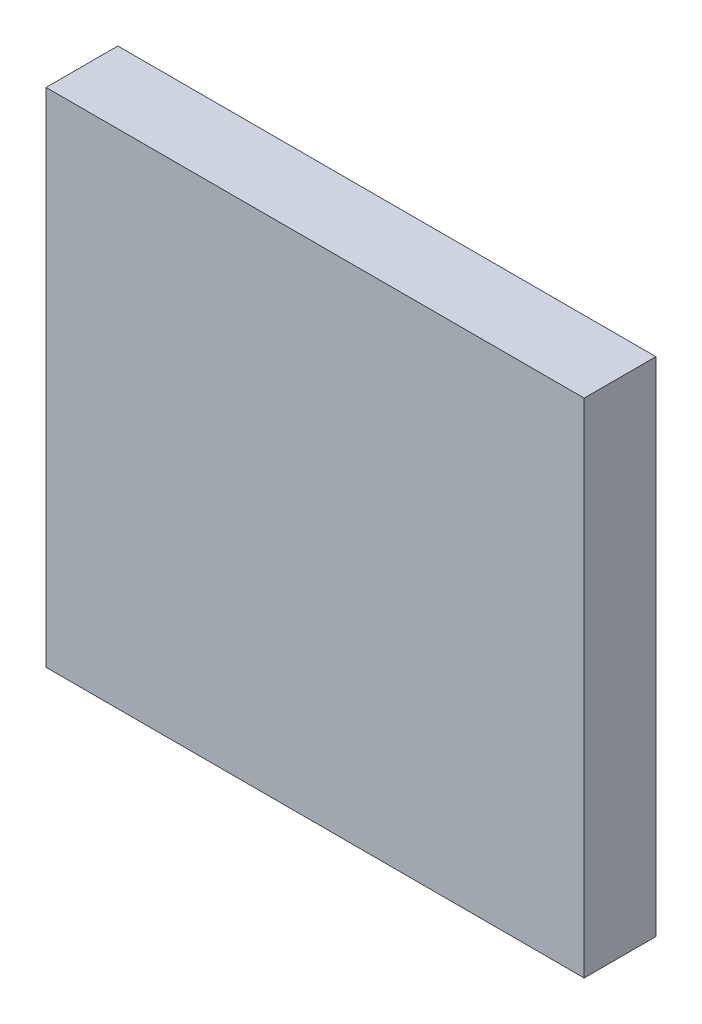
from build123d import *

# Parameters (mm, degrees)
SKETCH1_W           = 150
SKETCH1_H           = 140
BOSS_EXTRUDE1_DEPTH = 20


with BuildPart() as part:
    # Sketch1 → Boss-Extrude1 (new body)
    with BuildSketch(Plane.XY):
        Rectangle(SKETCH1_W, SKETCH1_H)
    extrude(amount=BOSS_EXTRUDE1_DEPTH)


solid = part.part
